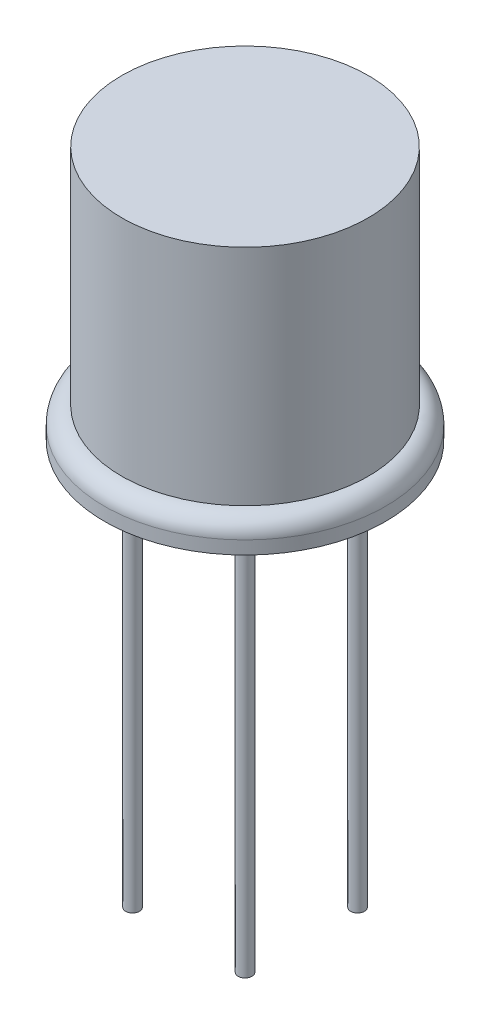
from build123d import *

# Parameters (mm, degrees)
BOSS_EXTRUDE1_DEPTH = 0.4318
SKETCH5_R           = 0.2286
BOSS_EXTRUDE2_DEPTH = 13.335


with BuildPart() as part:
    # Sketch2 → Boss-Extrude1 (new body)
    with BuildSketch(Plane(origin=(0, 0, 0), x_dir=(1, 0, 0), z_dir=(0, 1, 0))):
        with BuildLine():
            Line((-0.4445, 4.61413914), (-0.4445, 5.24913914))
            Line((-0.4445, 5.24913914), (0.4445, 5.24913914))
            Line((0.4445, 5.24913914), (0.4445, 4.61413914))
            ThreePointArc((0.4445, 4.61413914), (0, -4.6355), (-0.4445, 4.61413914))
        make_face()
    extrude(amount=BOSS_EXTRUDE1_DEPTH)

    # Sketch4 → Revolve1 (revolve)
    with BuildSketch(Plane.XY, mode=Mode.PRIVATE) as revolve1_sk:
        with BuildLine():
            Line((4.064, 1.0033), (4.064, 8.382))
            Line((4.064, 8.382), (0, 8.382))
            Line((0, 8.382), (0, 0.4318))
            Line((0, 0.4318), (4.6355, 0.4318))
            ThreePointArc((4.6355, 0.4318), (4.468111525, 0.835911525), (4.064, 1.0033))
        make_face()
    revolve(revolve1_sk.sketch.rotate(Axis((0, 8.382, 0), (0, -1, 0)), 180), axis=Axis((0, 8.382, 0), (0, -1, 0)))

    # Sketch5 → Boss-Extrude2 (add)
    with BuildSketch(Plane.XZ):
        with Locations(Location((-1.8542, -1.8542, 0), (0, 0, 90))):
            Circle(SKETCH5_R)
        with Locations(Location((1.8542, -1.8542, 0), (0, 0, 90))):
            Circle(SKETCH5_R)
        with Locations(Location((1.8542, 1.8542, 0), (0, 0, 90))):
            Circle(SKETCH5_R)
        with Locations(Location((-1.8542, 1.8542, 0), (0, 0, 90))):
            Circle(SKETCH5_R)
    extrude(amount=BOSS_EXTRUDE2_DEPTH)


solid = part.part
